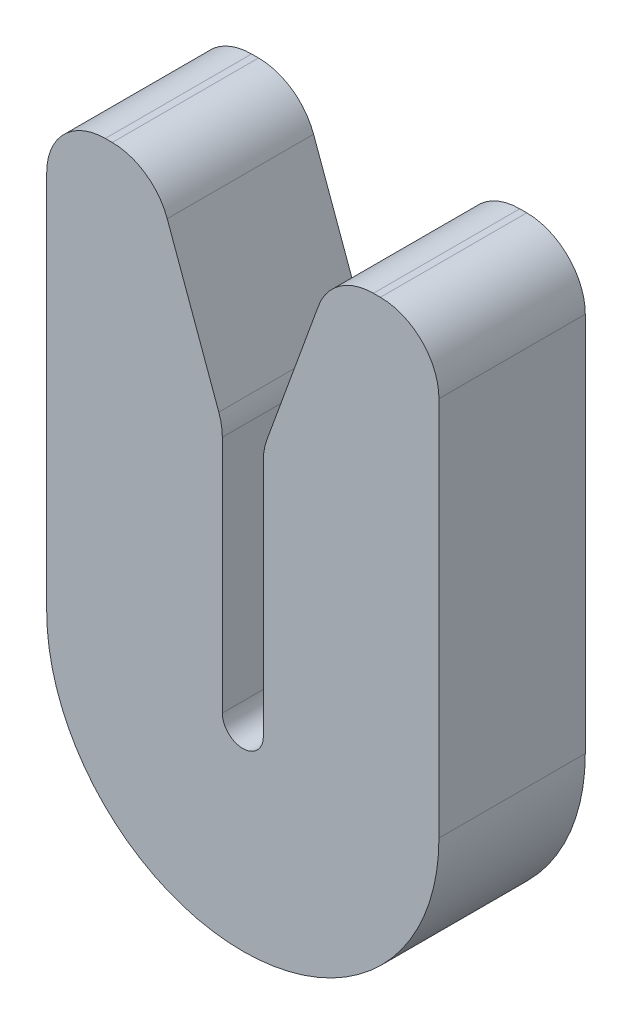
from build123d import *

# Parameters (mm, degrees)
BOSS_EXTRUDE1_DEPTH = 5
FILLET2_R           = 2


with BuildPart() as part:
    # Sketch1 → Boss-Extrude1 (new body)
    with BuildSketch(Plane.XY):
        with BuildLine():
            Line((-0.7, 0), (-0.7, 8.511007364))
            Line((-0.7, 8.511007364), (-3.06180017, 15))
            Line((-3.06180017, 15), (-6.7, 15))
            Line((-6.7, 15), (-6.7, 0))
            ThreePointArc((-6.7, 0), (0, -6.7), (6.7, 0))
            Line((6.7, 0), (6.7, 15))
            Line((6.7, 15), (3.06180017, 15))
            Line((3.06180017, 15), (0.7, 8.511007364))
            Line((0.7, 8.511007364), (0.7, 0))
            ThreePointArc((0.7, 0), (0, -0.7), (-0.7, 0))
        make_face()
    extrude(amount=BOSS_EXTRUDE1_DEPTH)

    # Fillet2
    fillet2_edges = [part.edges().sort_by_distance(p)[0] for p in [
        (3.06180017, 15, 2.5),
        (6.7, 15, 2.5),
        (-6.7, 15, 2.5),
        (-3.06180017, 15, 2.5),
        (-0.7, 8.511007364, 2.5),
        (0.7, 8.511007364, 2.5),
    ]]
    fillet(fillet2_edges, radius=FILLET2_R)


solid = part.part
